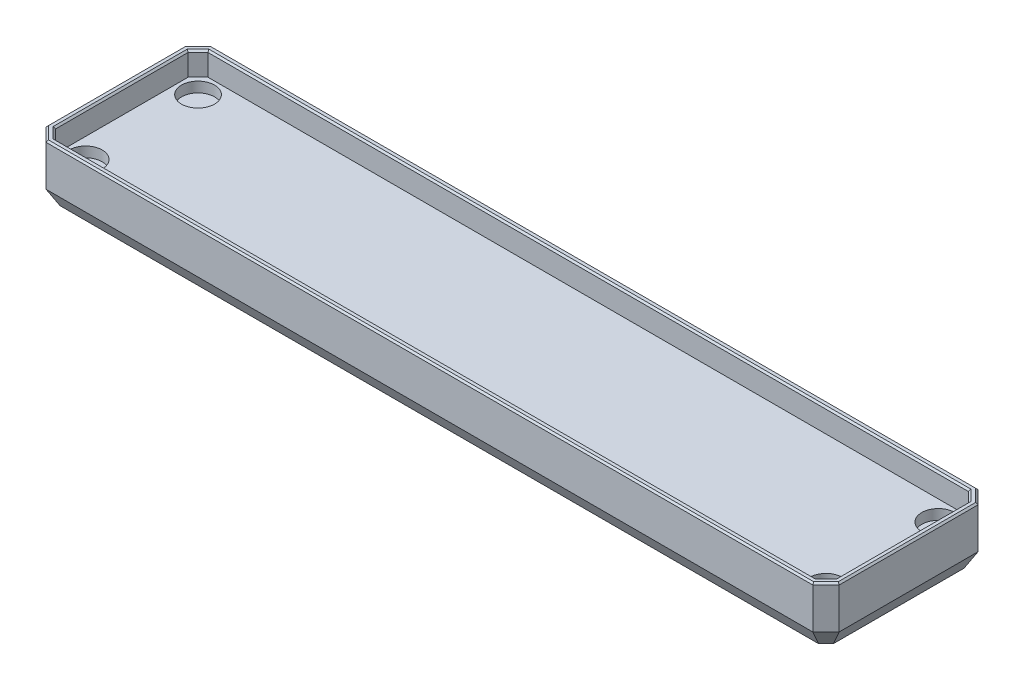
from build123d import *

# Parameters (mm, degrees)
SKETCH1_W           = 240
SKETCH1_H           = 50
BOSS_EXTRUDE1_DEPTH = 11
CHAMFER5_SIZE       = 4
SKETCH6_R           = 5
CUT_EXTRUDE5_DEPTH  = 3.1
CHAMFER9_SIZE       = 3
CHAMFER9_SIZE2      = 5.196152423
BOSS_EXTRUDE4_DEPTH = 7
CHAMFER13_SIZE      = 0.5
CHAMFER14_SIZE      = 0.5


with BuildPart() as part:
    # Sketch1 → Boss-Extrude1 (new body)
    with BuildSketch(Plane(origin=(0, 0, 0), x_dir=(1, 0, 0), z_dir=(0, 1, 0))):
        with Locations((115, 20)):
            Rectangle(SKETCH1_W, SKETCH1_H)
    extrude(amount=-BOSS_EXTRUDE1_DEPTH)

    # Chamfer5
    chamfer5_edges = [part.edges().sort_by_distance(p)[0] for p in [
        (235, -5.5, 5),
        (-5, -5.5, 5),
        (-5, -5.5, -45),
        (235, -5.5, -45),
    ]]
    chamfer(chamfer5_edges, length=CHAMFER5_SIZE)

    # Sketch6 → Cut-Extrude5 (cut)
    with BuildSketch(Plane(origin=(0, 0, 0), x_dir=(1, 0, 0), z_dir=(0, 1, 0))):
        with Locations((3, 37)):
            Circle(SKETCH6_R)
        with Locations((227, 37)):
            Circle(SKETCH6_R)
        with Locations((227, 3)):
            Circle(SKETCH6_R)
        with Locations((3, 3)):
            Circle(SKETCH6_R)
    extrude(amount=-CUT_EXTRUDE5_DEPTH, mode=Mode.SUBTRACT)

    # Chamfer9
    chamfer9_edges = [part.edges().sort_by_distance(p)[0] for p in [
        (-3, -11, 3),
        (115, -11, 5),
        (233, -11, 3),
        (235, -11, -20),
        (233, -11, -43),
        (115, -11, -45),
        (-3, -11, -43),
        (-5, -11, -20),
    ]]
    chamfer9_side = [part.faces().sort_by_distance(p)[0] for p in [
        (115, -11, -20),
    ]]
    chamfer(chamfer9_edges, length=CHAMFER9_SIZE, length2=CHAMFER9_SIZE2, reference=chamfer9_side[0])

    # Sketch8 → Boss-Extrude4 (add)
    with BuildSketch(Plane(origin=(0, 0, 0), x_dir=(1, 0, 0), z_dir=(0, 1, 0))):
        Polygon((-5, 41), (-1, 45), (231, 45), (235, 41), (235, -1), (231, -5), (-1, -5), (-5, -1), align=None)
        Polygon((-3.05, -0.05), (-0.05, -3.05), (230.05, -3.05), (233.05, -0.05), (233.05, 40.05), (230.05, 43.05), (-0.05, 43.05), (-3.05, 40.05), align=None, mode=Mode.SUBTRACT)
    extrude(amount=BOSS_EXTRUDE4_DEPTH)

    # Chamfer13
    chamfer13_edges = [part.edges().sort_by_distance(p)[0] for p in [
        (231.55, 7, 1.55),
        (115, 7, 3.05),
        (-1.55, 7, 1.55),
        (231.55, 7, -41.55),
        (115, 7, -43.05),
        (-1.55, 7, -41.55),
        (-3.05, 7, -20),
        (233.05, 7, -20),
    ]]
    chamfer(chamfer13_edges, length=CHAMFER13_SIZE)

    # Chamfer14
    chamfer14_edges = [part.edges().sort_by_distance(p)[0] for p in [
        (-3, 7, 3),
        (115, 7, 5),
        (233, 7, 3),
        (235, 7, -20),
        (233, 7, -43),
        (115, 7, -45),
        (-3, 7, -43),
        (-5, 7, -20),
    ]]
    chamfer(chamfer14_edges, length=CHAMFER14_SIZE)


solid = part.part
